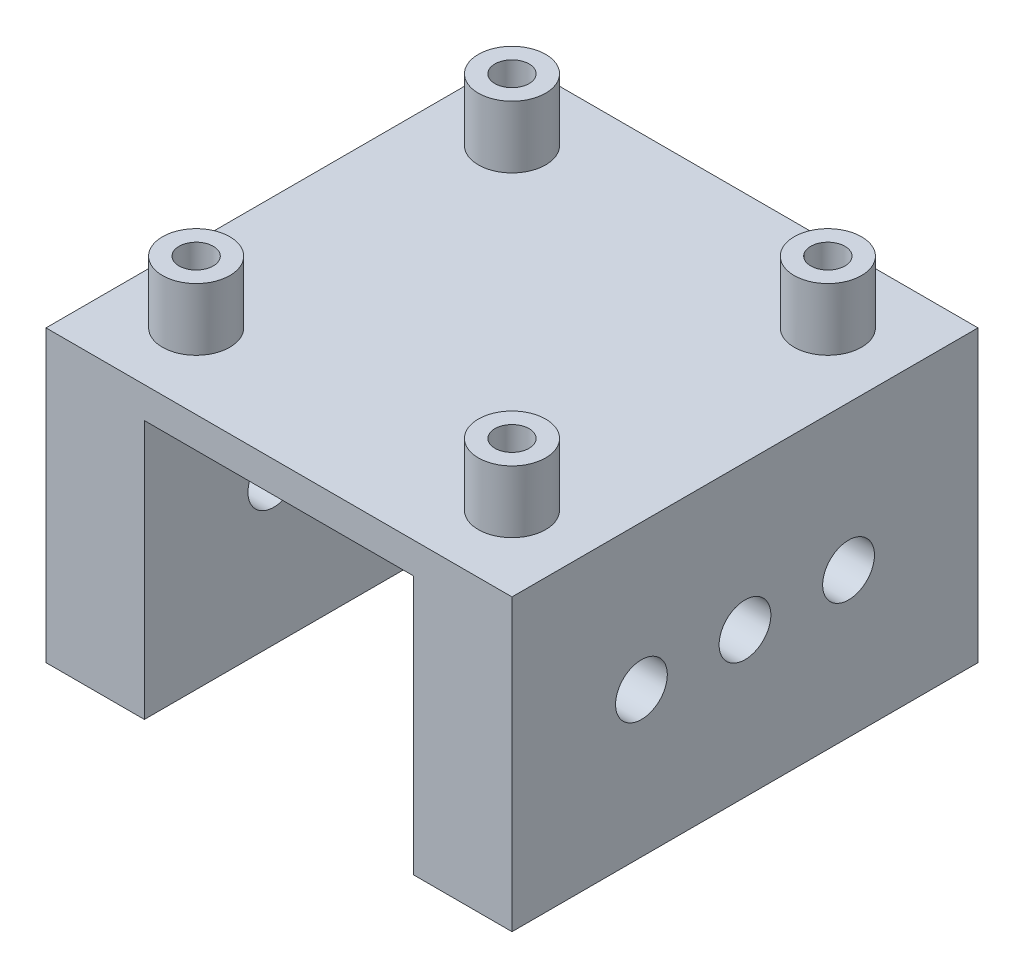
from build123d import *

# Parameters (mm, degrees)
SKETCH1_R             = 3.25
SKETCH1_R_2           = 1.65
BOSS_EXTRUDE1_DEPTH   = 6
BOSS_EXTRUDE1_2_DEPTH = 6
BOSS_EXTRUDE1_3_DEPTH = 6
BOSS_EXTRUDE1_4_DEPTH = 6
SKETCH2_W             = 45
SKETCH2_H             = 45
BOSS_EXTRUDE2_DEPTH   = 3
CUT_EXTRUDE1_START    = -3
SKETCH1_2_R           = 1.65
CUT_EXTRUDE1_DEPTH    = 3
SKETCH7_W             = 9.5
SKETCH7_H             = 45
BOSS_EXTRUDE3_DEPTH   = 25
SKETCH8_R             = 2.5
CUT_EXTRUDE2_DEPTH    = 58.578207683


with BuildPart() as part:
    # Sketch1 → Boss-Extrude1 (new body)
    with BuildSketch(Plane(origin=(0, 0, 0), x_dir=(1, 0, 0), z_dir=(0, 1, 0))):
        with Locations((-15.25, 15.25)):
            Circle(SKETCH1_R)
        with Locations((-15.25, 15.25)):
            Circle(SKETCH1_R_2, mode=Mode.SUBTRACT)
    extrude(amount=BOSS_EXTRUDE1_DEPTH)



with BuildPart() as body_2:
    # Sketch1 → Boss-Extrude1 2 (new body)
    with BuildSketch(Plane(origin=(0, 0, 0), x_dir=(1, 0, 0), z_dir=(0, 1, 0))):
        with Locations((15.25, 15.25)):
            Circle(SKETCH1_R)
        with Locations((15.25, 15.25)):
            Circle(SKETCH1_R_2, mode=Mode.SUBTRACT)
    extrude(amount=BOSS_EXTRUDE1_2_DEPTH)


with BuildPart() as body_3:
    # Sketch1 → Boss-Extrude1 3 (new body)
    with BuildSketch(Plane(origin=(0, 0, 0), x_dir=(1, 0, 0), z_dir=(0, 1, 0))):
        with Locations((15.25, -15.25)):
            Circle(SKETCH1_R)
        with Locations((15.25, -15.25)):
            Circle(SKETCH1_R_2, mode=Mode.SUBTRACT)
    extrude(amount=BOSS_EXTRUDE1_3_DEPTH)


with BuildPart() as body_4:
    # Sketch1 → Boss-Extrude1 4 (new body)
    with BuildSketch(Plane(origin=(0, 0, 0), x_dir=(1, 0, 0), z_dir=(0, 1, 0))):
        with Locations((-15.25, -15.25)):
            Circle(SKETCH1_R)
        with Locations((-15.25, -15.25)):
            Circle(SKETCH1_R_2, mode=Mode.SUBTRACT)
    extrude(amount=BOSS_EXTRUDE1_4_DEPTH)


with BuildPart() as part_1:
    add(part.part)

    add(body_2.part)  # Boss-Extrude2 merges body 2

    add(body_3.part)  # Boss-Extrude2 merges body 3

    add(body_4.part)  # Boss-Extrude2 merges body 4
    # Sketch2 → Boss-Extrude2 (add)
    with BuildSketch(Plane(origin=(0, 0, 0), x_dir=(1, 0, 0), z_dir=(0, 1, 0))):
        Rectangle(SKETCH2_W, SKETCH2_H)
    extrude(amount=-BOSS_EXTRUDE2_DEPTH)

    # Sketch1<2> → Cut-Extrude1 (cut)
    with BuildSketch(Plane(origin=(0, 0, 0), x_dir=(1, 0, 0), z_dir=(0, 1, 0)).offset(CUT_EXTRUDE1_START)):
        with Locations((-15.25, 15.25)):
            Circle(SKETCH1_2_R)
        with Locations((15.25, 15.25)):
            Circle(SKETCH1_2_R)
        with Locations((15.25, -15.25)):
            Circle(SKETCH1_2_R)
        with Locations((-15.25, -15.25)):
            Circle(SKETCH1_2_R)
    extrude(amount=CUT_EXTRUDE1_DEPTH, mode=Mode.SUBTRACT)

    # Sketch7 → Boss-Extrude3 (add)
    with BuildSketch(Plane.XZ.offset(3)):
        with Locations((-17.75, 0)):
            Rectangle(SKETCH7_W, SKETCH7_H)
        with Locations((17.75, 0)):
            Rectangle(SKETCH7_W, SKETCH7_H)
    extrude(amount=BOSS_EXTRUDE3_DEPTH)

    # Sketch8 → Cut-Extrude2 (cut, through all)
    with BuildSketch(Plane(origin=(22.5, 0, 0), x_dir=(0, 0, -1), z_dir=(1, 0, 0))):
        with Locations((0, -14)):
            Circle(SKETCH8_R)
        with Locations((-10, -14)):
            Circle(SKETCH8_R)
        with Locations((10, -14)):
            Circle(SKETCH8_R)
    extrude(amount=-CUT_EXTRUDE2_DEPTH, mode=Mode.SUBTRACT)


solid = part_1.part
